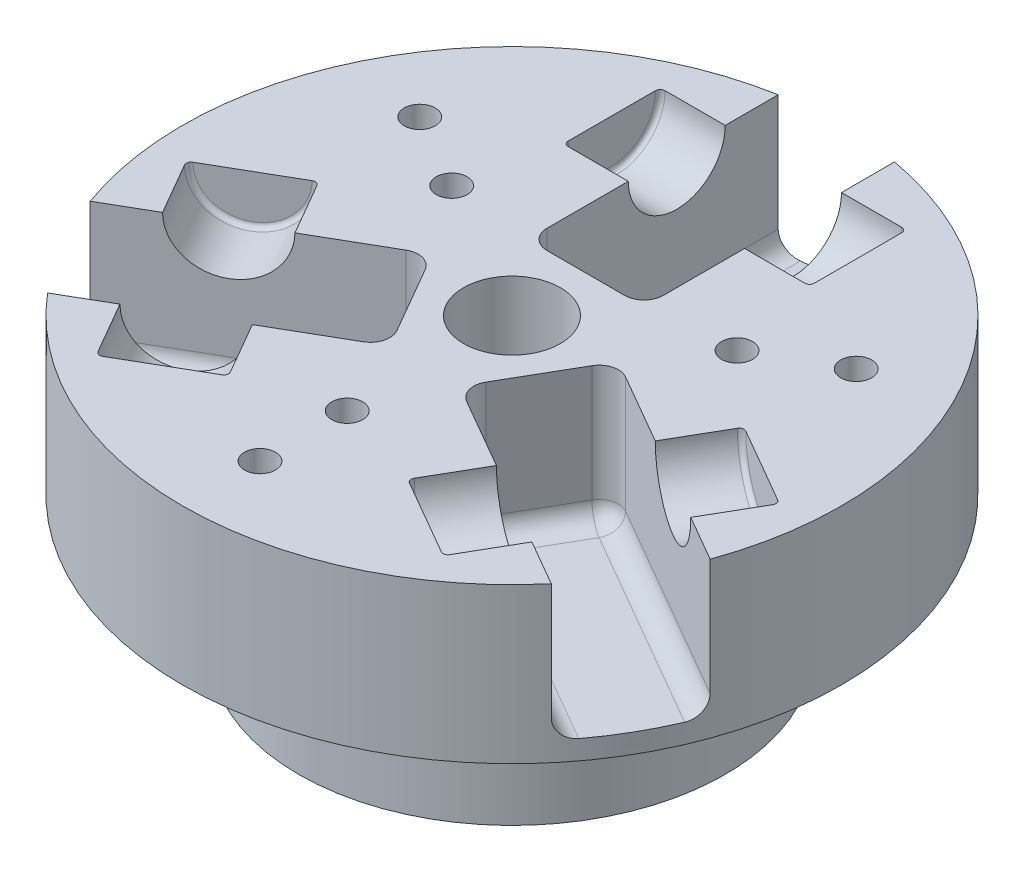
from build123d import *

# Parameters (mm, degrees)
SKETCH1_R                 = 17
BOSS_EXTRUDE1_DEPTH       = 14
SKETCH9_W                 = 6
SKETCH9_H                 = 13.19
CUT_EXTRUDE1_DEPTH        = 28.820855486
SKETCH10_R                = 2.5
CUT_EXTRUDE2_DEPTH        = 6.35
FILLET2_R                 = 1
CIRPATTERN2_COUNT         = 3
FILLET2_OF_CIRPATTERN2_R  = 1
SKETCH12_R                = 20
CUT_EXTRUDE3_DEPTH        = 10
BOSS_EXTRUDE2_START       = 1
SKETCH13_R                = 17
BOSS_EXTRUDE2_DEPTH       = 1
M2X0_4_TAPPED_HOLE3_D     = 1.6
M2X0_4_TAPPED_HOLE3_DEPTH = 7
M2X0_4_TAPPED_HOLE3_TIP   = 0.480688495
FILLET3_R                 = 1
SKETCH14_R                = 11
SKETCH14_R_2              = 9.652
BOSS_EXTRUDE3_DEPTH       = 7
SKETCH20_R                = 2.5
CUT_EXTRUDE5_DEPTH        = 8
FILLET4_R                 = 0.25


with BuildPart() as part:
    # Sketch1 → Boss-Extrude1 (new body)
    with BuildSketch(Plane(origin=(0, 0, 0), x_dir=(1, 0, 0), z_dir=(0, 1, 0))):
        with Locations(Location((0, 0, 0), (0, 0, 270))):
            Circle(SKETCH1_R)
    extrude(amount=BOSS_EXTRUDE1_DEPTH)

    # Sketch9 → Cut-Extrude1 (cut, through all)
    with BuildSketch(Plane(origin=(0, 14, 0), x_dir=(1, 0, 0), z_dir=(0, 1, 0))):
        with Locations((0, 10.405)):
            Rectangle(SKETCH9_W, SKETCH9_H)
    cut_extrude1 = extrude(amount=-CUT_EXTRUDE1_DEPTH, mode=Mode.SUBTRACT)

    # Sketch10 → Cut-Extrude2 (cut, symmetric)
    with BuildSketch(Plane(origin=(0, 0, 0), x_dir=(0, 0, -1), z_dir=(1, 0, 0))):
        with Locations((11.5, 7)):
            Circle(SKETCH10_R)
    cut_extrude2 = extrude(amount=CUT_EXTRUDE2_DEPTH, both=True, mode=Mode.SUBTRACT)

    # Fillet2
    fillet2_edges = [part.edges().sort_by_distance(p)[0] for p in [
        (-3, 7, -3.81),
        (3, 7, -3.81),
    ]]
    fillet(fillet2_edges, radius=FILLET2_R)

    # CirPattern2: Cut-Extrude1, Cut-Extrude2 ×3 about axis
    cirpattern2_axis = Axis((0, 0, 0), (0, 1, 0))
    add([cut_extrude1.rotate(cirpattern2_axis, i * 360 / CIRPATTERN2_COUNT) for i in range(1, CIRPATTERN2_COUNT)], mode=Mode.SUBTRACT)
    add([cut_extrude2.rotate(cirpattern2_axis, i * 360 / CIRPATTERN2_COUNT) for i in range(1, CIRPATTERN2_COUNT)], mode=Mode.SUBTRACT)

    # Fillet2 of CirPattern2
    fillet2_of_cirpattern2_edges = [part.edges().sort_by_distance(p)[0] for p in [
        (-1.799556788, 7, 4.503076211),
        (-4.799556788, 7, -0.693076211),
        (4.799556788, 7, -0.693076211),
        (1.799556788, 7, 4.503076211),
    ]]
    fillet(fillet2_of_cirpattern2_edges, radius=FILLET2_OF_CIRPATTERN2_R)

    # Sketch12 → Cut-Extrude3 (cut)
    with BuildSketch(Plane(origin=(0, 7, 0), x_dir=(1, 0, 0), z_dir=(0, 1, 0))):
        Circle(SKETCH12_R)
    extrude(amount=CUT_EXTRUDE3_DEPTH, mode=Mode.SUBTRACT)

    # Sketch13 → Boss-Extrude2 (add)
    with BuildSketch(Plane.XZ.offset(BOSS_EXTRUDE2_START)):
        with Locations(Location((0, 0, 0), (0, 0, 270))):
            Circle(SKETCH13_R)
    extrude(amount=-BOSS_EXTRUDE2_DEPTH)

    # M2x0.4 Tapped Hole3
    with Locations(Plane(origin=(0, 7, 0), x_dir=(1, 0, 0), z_dir=(0, 1, 0))):
        with Locations((-11.258330249, 6.5), (11.258330249, 6.5), (0, -13), (-7.361215932, 4.25), (7.361215932, 4.25), (0, -8.5)):
            Hole(M2X0_4_TAPPED_HOLE3_D / 2, depth=M2X0_4_TAPPED_HOLE3_DEPTH)
            with Locations((0, 0, -(M2X0_4_TAPPED_HOLE3_DEPTH + M2X0_4_TAPPED_HOLE3_TIP / 2))):  # 118° drill point
                Cone(0, M2X0_4_TAPPED_HOLE3_D / 2, M2X0_4_TAPPED_HOLE3_TIP, mode=Mode.SUBTRACT)

    # Fillet3
    fillet3_edges = [part.edges().sort_by_distance(p)[0] for p in [
        (-10.828479469, 0, 2.787723921),
        (-4.906763147, 0, -0.292976634),
        (-3.299556788, 0, 1.905),
        (-2.199656366, 0, 4.395869853),
        (7.828479469, 0, 7.983876344),
        (2.199656366, 0, 4.395869853),
        (10.828479469, 0, 2.787723921),
        (4.906763147, 0, -0.292976634),
        (-3, 0, -10.771600265),
        (-2.707106781, 0, -4.102893219),
        (0, 0, -3.81),
        (2.707106781, 0, -4.102893219),
        (-7.828479469, 0, 7.983876344),
        (3.299556788, 0, 1.905),
        (3, 0, -10.771600265),
    ]]
    fillet(fillet3_edges, radius=FILLET3_R)

    # Sketch14 → Boss-Extrude3 (add)
    with BuildSketch(Plane.XZ.offset(1)):
        with Locations(Location((0, 0, 0), (0, 0, 270))):
            Circle(SKETCH14_R)
        with Locations(Location((0, 0, 0), (0, 0, 270))):
            Circle(SKETCH14_R_2, mode=Mode.SUBTRACT)
    extrude(amount=BOSS_EXTRUDE3_DEPTH)

    # Sketch20 → Cut-Extrude5 (cut)
    with BuildSketch(Plane.XZ.offset(1)):
        with Locations(Location((0, 0, 0), (0, 0, 270))):
            Circle(SKETCH20_R)
    extrude(amount=-CUT_EXTRUDE5_DEPTH, mode=Mode.SUBTRACT)

    # Fillet4
    fillet4_edges = [part.edges().sort_by_distance(p)[0] for p in [
        (-6.784292144, 4.5, 11.249261314),
        (-13.134292144, 4.5, 0.250738686),
        (13.134292144, 4.5, 0.250738686),
        (6.784292144, 4.5, 11.249261314),
        (-6.35, 4.5, -11.5),
        (6.35, 4.5, -11.5),
    ]]
    fillet(fillet4_edges, radius=FILLET4_R)


solid = part.part
